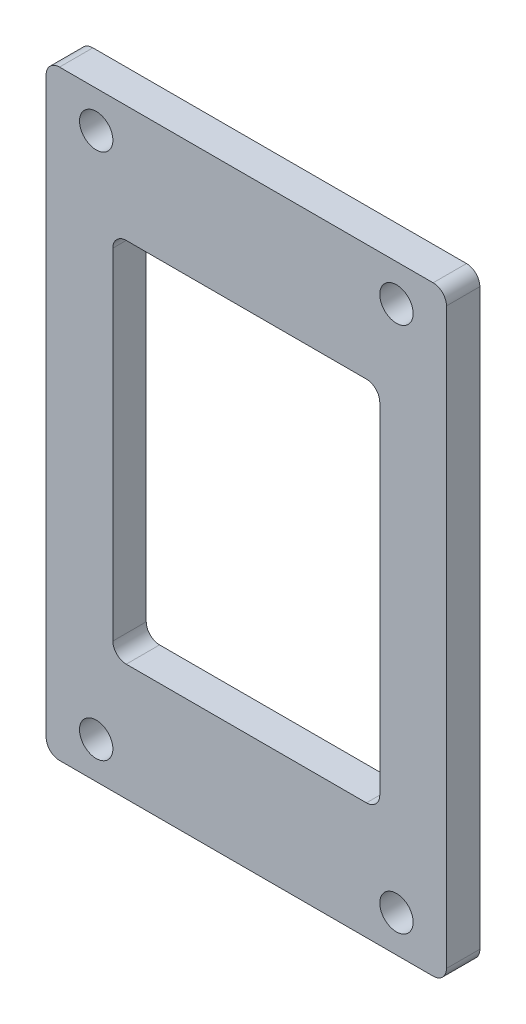
from build123d import *

# Parameters (mm, degrees)
BOSS_EXTRU_1_DEPTH      = 5
ENL_V_MAT_EXTRU_1_DEPTH = 55.313902456
ESQUISSE3_R             = 2.5
ENL_V_MAT_EXTRU_2_DEPTH = 55.313902456


with BuildPart() as part:
    # Esquisse1 → Boss.-Extru.1 (new body)
    with BuildSketch(Plane.XY):
        with BuildLine():
            Line((28, -45), (-28, -45))
            ThreePointArc((-28, -45), (-29.414213562, -44.414213562), (-30, -43))
            Line((-30, -43), (-30, 43))
            ThreePointArc((-30, 43), (-29.414213562, 44.414213562), (-28, 45))
            Line((-28, 45), (28, 45))
            ThreePointArc((28, 45), (29.414213562, 44.414213562), (30, 43))
            Line((30, 43), (30, -43))
            ThreePointArc((30, -43), (29.414213562, -44.414213562), (28, -45))
        make_face()
    extrude(amount=BOSS_EXTRU_1_DEPTH)

    # Esquisse2 → Enlèv. mat.-Extru.1 (cut, through all)
    with BuildSketch(Plane(origin=(0, 0, 0), x_dir=(-1, 0, 0), z_dir=(0, 0, -1))):
        with BuildLine():
            Line((18, -27.5), (-18, -27.5))
            ThreePointArc((-18, -27.5), (-19.414213562, -26.914213562), (-20, -25.5))
            Line((-20, -25.5), (-20, 25.5))
            ThreePointArc((-20, 25.5), (-19.414213562, 26.914213562), (-18, 27.5))
            Line((-18, 27.5), (18, 27.5))
            ThreePointArc((18, 27.5), (19.414213562, 26.914213562), (20, 25.5))
            Line((20, 25.5), (20, -25.5))
            ThreePointArc((20, -25.5), (19.414213562, -26.914213562), (18, -27.5))
        make_face()
    extrude(amount=-ENL_V_MAT_EXTRU_1_DEPTH, mode=Mode.SUBTRACT)

    # Esquisse3 → Enlèv. mat.-Extru.2 (cut, through all)
    with BuildSketch(Plane.XY.offset(5)):
        with Locations((-22.5, -39.5)):
            Circle(ESQUISSE3_R)
        with Locations((22.5, -39.5)):
            Circle(ESQUISSE3_R)
        with Locations((-22.5, 39.5)):
            Circle(ESQUISSE3_R)
        with Locations((22.5, 39.5)):
            Circle(ESQUISSE3_R)
    extrude(amount=-ENL_V_MAT_EXTRU_2_DEPTH, mode=Mode.SUBTRACT)


solid = part.part
